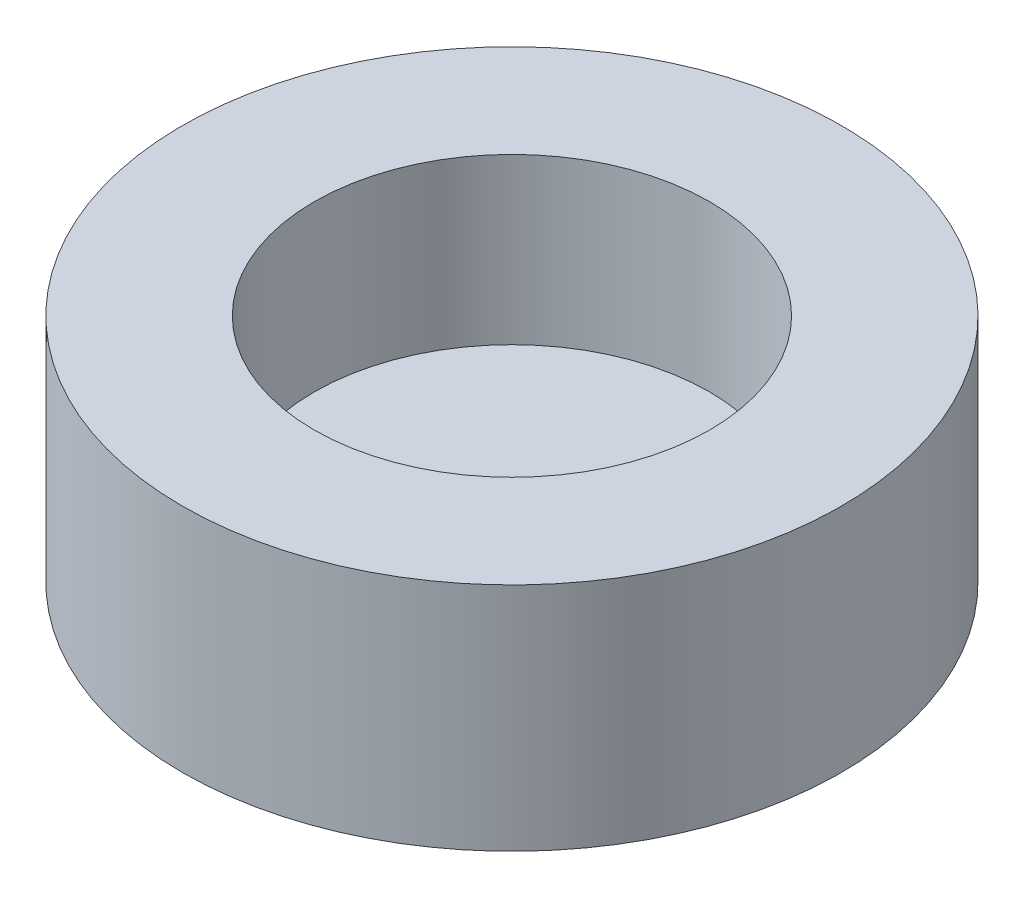
from build123d import *

# Parameters (mm, degrees)
SKIZZE1_R                       = 10
AUFSATZ_LINEAR_AUSTRAGEN1_DEPTH = 7
SKIZZE2_R                       = 6
SCHNITT_LINEAR_AUSTRAGEN1_DEPTH = 5


with BuildPart() as part:
    # Skizze1 → Aufsatz-Linear austragen1 (new body)
    with BuildSketch(Plane(origin=(0, 0, 0), x_dir=(1, 0, 0), z_dir=(0, 1, 0))):
        with Locations(Location((0, 0, 0), (0, 0, 270))):
            Circle(SKIZZE1_R)
    extrude(amount=AUFSATZ_LINEAR_AUSTRAGEN1_DEPTH)

    # Skizze2 → Schnitt-Linear austragen1 (cut)
    with BuildSketch(Plane(origin=(0, 7, 0), x_dir=(1, 0, 0), z_dir=(0, 1, 0))):
        with Locations(Location((0, 0, 0), (0, 0, 270))):
            Circle(SKIZZE2_R)
    extrude(amount=-SCHNITT_LINEAR_AUSTRAGEN1_DEPTH, mode=Mode.SUBTRACT)


solid = part.part
